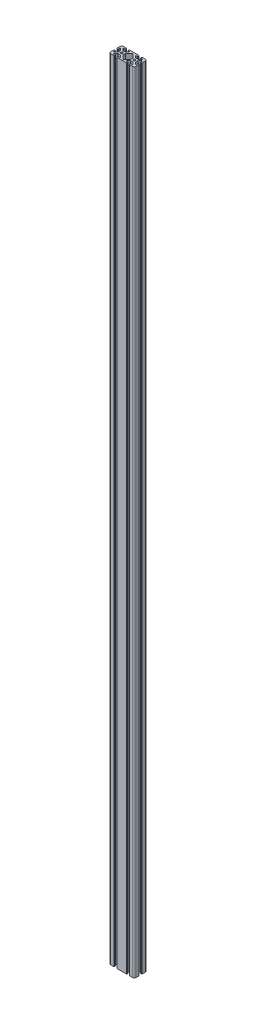
from build123d import *

# Parameters (mm, degrees)
BOSS_EXTRUDE1_DEPTH   = 2500
SKETCH3_R             = 3.4
CUT_EXTRUDE1_DEPTH    = 2502.599488327
CUT_EXTRUDE2_DEPTH    = 2502.599488327
FILLET1_R             = 1
FILLET2_R             = 1
FILLET3_R             = 1
CUT_EXTRUDE3_DEPTH    = 2502.599488327
CUT_EXTRUDE4_DEPTH    = 2502.599488327
FILLET4_R             = 1
FILLET5_R             = 1
FILLET6_R             = 1
FILLET7_R             = 1
FILLET8_R             = 1
FILLET9_R             = 1
FILLET10_R            = 1
FILLET11_R            = 1
MIRROR11_COPY_1_DEPTH = 2502.599488327
MIRROR11_COPY_2_DEPTH = 2502.599488327
CUT_EXTRUDE5_DEPTH    = 2502.599488327


with BuildPart() as part:
    # Sketch1 → Boss-Extrude1 (new body)
    with BuildSketch(Plane(origin=(0, 0, 0), x_dir=(1, 0, 0), z_dir=(0, 1, 0))):
        with BuildLine():
            Line((5, 0), (75, 0))
            ThreePointArc((75, 0), (78.535533906, -1.464466094), (80, -5))
            Line((80, -5), (80, -35))
            ThreePointArc((80, -35), (78.535533906, -38.535533906), (75, -40))
            Line((75, -40), (5, -40))
            ThreePointArc((5, -40), (1.464466094, -38.535533906), (0, -35))
            Line((0, -35), (0, -5))
            ThreePointArc((0, -5), (1.464466094, -1.464466094), (5, 0))
        make_face()
    extrude(amount=BOSS_EXTRUDE1_DEPTH)

    # Sketch3 → Cut-Extrude1 (cut, through all)
    with BuildSketch(Plane(origin=(0, 2500, 0), x_dir=(1, 0, 0), z_dir=(0, 1, 0))):
        with Locations(Location((20, -20, 0), (0, 0, 270))):
            Circle(SKETCH3_R)
    cut_extrude1 = extrude(amount=-CUT_EXTRUDE1_DEPTH, mode=Mode.SUBTRACT)

    # Mirror3: Cut-Extrude1 across plane
    add(cut_extrude1.mirror(Plane(origin=(40, 0, 0), x_dir=(0, 0, 1), z_dir=(1, 0, 0))), mode=Mode.SUBTRACT)

    # Sketch7 → Cut-Extrude2 (cut, through all)
    with BuildSketch(Plane(origin=(0, 0, 0), x_dir=(-1, 0, 0), z_dir=(0, -1, 0))):
        with BuildLine():
            Line((-15.9, -40), (-24.1, -40))
            Line((-24.1, -40), (-24.1, -36.5))
            ThreePointArc((-24.1, -36.5), (-24.392893219, -35.792893219), (-25.1, -35.5))
            Line((-25.1, -35.5), (-29.489753594, -35.5))
            ThreePointArc((-29.489753594, -35.5), (-30.415270825, -34.8787055), (-30.190750526, -33.786835712))
            Line((-30.190750526, -33.786835712), (-24.391814382, -28.086835712))
            ThreePointArc((-24.391814382, -28.086835712), (-24.069522951, -27.874482769), (-23.69081745, -27.8))
            Line((-23.69081745, -27.8), (-16.309186536, -27.8))
            ThreePointArc((-16.309186536, -27.8), (-15.930477876, -27.874484063), (-15.608184734, -28.086840499))
            Line((-15.608184734, -28.086840499), (-9.809327805, -33.786840499))
            ThreePointArc((-9.809327805, -33.786840499), (-9.584813669, -34.87870866), (-10.510329607, -35.5))
            Line((-10.510329607, -35.5), (-14.9, -35.5))
            ThreePointArc((-14.9, -35.5), (-15.607106781, -35.792893219), (-15.9, -36.5))
            Line((-15.9, -36.5), (-15.9, -40))
        make_face()
    cut_extrude2 = extrude(amount=-CUT_EXTRUDE2_DEPTH, mode=Mode.SUBTRACT)

    # Fillet1
    fillet1_edges = [part.edges().sort_by_distance(p)[0] for p in [
        (15.9, 1250, 40),
        (24.1, 1250, 40),
    ]]
    fillet(fillet1_edges, radius=FILLET1_R)

    # Mirror8: Cut-Extrude2 across plane
    add(cut_extrude2.mirror(Plane(origin=(40, 0, 0), x_dir=(0, 0, 1), z_dir=(1, 0, 0))), mode=Mode.SUBTRACT)

    # Fillet2
    fillet2_edges = [part.edges().sort_by_distance(p)[0] for p in [
        (55.9, 1250, 40),
    ]]
    fillet(fillet2_edges, radius=FILLET2_R)

    # Fillet3
    fillet3_edges = [part.edges().sort_by_distance(p)[0] for p in [
        (64.1, 1250, 40),
    ]]
    fillet(fillet3_edges, radius=FILLET3_R)

    # Sketch9 → Cut-Extrude3 (cut, through all)
    with BuildSketch(Plane(origin=(0, 0, 0), x_dir=(1, 0, 0), z_dir=(0, 1, 0))):
        with BuildLine():
            Line((14.899846923, -4.500713815), (10.450461284, -4.500713815))
            ThreePointArc((10.450461284, -4.500713815), (9.526581751, -5.118030383), (9.743354502, -6.207820596))
            Line((9.743354502, -6.207820596), (15.442640687, -11.907106781))
            ThreePointArc((15.442640687, -11.907106781), (15.767064036, -12.123879533), (16.149747468, -12.2))
            Line((16.149747468, -12.2), (23.850252532, -12.2))
            ThreePointArc((23.850252532, -12.2), (24.232935964, -12.123879533), (24.557359313, -11.907106781))
            Line((24.557359313, -11.907106781), (30.257359313, -6.207106781))
            ThreePointArc((30.257359313, -6.207106781), (30.474132064, -5.117316568), (29.550252532, -4.5))
            Line((29.550252532, -4.5), (25.099846964, -4.5))
            ThreePointArc((25.099846964, -4.5), (24.392724723, -4.207091321), (24.099846965, -3.499956273))
            Line((24.099846965, -3.499956273), (24.100000008, 0))
            Line((24.100000008, 0), (15.9, 0))
            Line((15.9, 0), (15.899846922, -3.500757542))
            ThreePointArc((15.899846922, -3.500757542), (15.606938244, -4.207836056), (14.899846923, -4.500713815))
        make_face()
    cut_extrude3 = extrude(amount=CUT_EXTRUDE3_DEPTH, mode=Mode.SUBTRACT)

    # Mirror9: Cut-Extrude3 across plane
    add(cut_extrude3.mirror(Plane(origin=(40, 0, 0), x_dir=(0, 0, 1), z_dir=(1, 0, 0))), mode=Mode.SUBTRACT)

    # Sketch10 → Cut-Extrude4 (cut, through all)
    with BuildSketch(Plane(origin=(0, 0, 0), x_dir=(1, 0, 0), z_dir=(0, 1, 0))):
        with BuildLine():
            Line((4.5, -14.9), (4.5, -10.58605332))
            ThreePointArc((4.5, -10.58605332), (5.126159695, -9.658560233), (6.220486853, -9.892584724))
            Line((6.220486853, -9.892584724), (11.920486853, -15.814662646))
            ThreePointArc((11.920486853, -15.814662646), (12.127493087, -16.134290938), (12.2, -16.508131242))
            Line((12.2, -16.508131242), (12.2, -23.491868758))
            ThreePointArc((12.2, -23.491868758), (12.127493087, -23.865709062), (11.920486853, -24.185337354))
            Line((11.920486853, -24.185337354), (6.220486853, -30.107415276))
            ThreePointArc((6.220486853, -30.107415276), (5.126159695, -30.341439767), (4.5, -29.41394668))
            Line((4.5, -29.41394668), (4.5, -25.1))
            ThreePointArc((4.5, -25.1), (4.207106781, -24.392893219), (3.5, -24.1))
            Line((3.5, -24.1), (0, -24.1))
            Line((0, -24.1), (0, -15.9))
            Line((0, -15.9), (3.5, -15.9))
            ThreePointArc((3.5, -15.9), (4.207106781, -15.607106781), (4.5, -14.9))
        make_face()
    cut_extrude4 = extrude(amount=CUT_EXTRUDE4_DEPTH, mode=Mode.SUBTRACT)

    # Fillet4
    fillet4_edges = [part.edges().sort_by_distance(p)[0] for p in [
        (24.100000008, 1250, 0),
    ]]
    fillet(fillet4_edges, radius=FILLET4_R)

    # Fillet5
    fillet5_edges = [part.edges().sort_by_distance(p)[0] for p in [
        (64.1, 1250, 0),
    ]]
    fillet(fillet5_edges, radius=FILLET5_R)

    # Fillet6
    fillet6_edges = [part.edges().sort_by_distance(p)[0] for p in [
        (55.899999992, 1250, 0),
    ]]
    fillet(fillet6_edges, radius=FILLET6_R)

    # Fillet7
    fillet7_edges = [part.edges().sort_by_distance(p)[0] for p in [
        (15.9, 1250, 0),
    ]]
    fillet(fillet7_edges, radius=FILLET7_R)

    # Fillet8
    fillet8_edges = [part.edges().sort_by_distance(p)[0] for p in [
        (0, 1250, 24.1),
    ]]
    fillet(fillet8_edges, radius=FILLET8_R)

    # Fillet9
    fillet9_edges = [part.edges().sort_by_distance(p)[0] for p in [
        (0, 1250, 15.9),
    ]]
    fillet(fillet9_edges, radius=FILLET9_R)

    # Mirror10: Cut-Extrude4 across plane
    add(cut_extrude4.mirror(Plane(origin=(40, 0, 0), x_dir=(0, 0, 1), z_dir=(1, 0, 0))), mode=Mode.SUBTRACT)

    # Fillet10
    fillet10_edges = [part.edges().sort_by_distance(p)[0] for p in [
        (80, 1250, 15.9),
    ]]
    fillet(fillet10_edges, radius=FILLET10_R)

    # Fillet11
    fillet11_edges = [part.edges().sort_by_distance(p)[0] for p in [
        (80, 1250, 24.1),
    ]]
    fillet(fillet11_edges, radius=FILLET11_R)

    # Mirror11 copy 1 sketch → Mirror11 copy 1 (cut, through all)
    with BuildSketch(Plane(origin=(40, 0, 0), x_dir=(1, 0, 0), z_dir=(0, 1, 0))):
        with BuildLine():
            Line((4.5, -14.9), (4.5, -10.58605332))
            ThreePointArc((4.5, -10.58605332), (5.126159695, -9.658560233), (6.220486853, -9.892584724))
            Line((6.220486853, -9.892584724), (11.920486853, -15.814662646))
            ThreePointArc((11.920486853, -15.814662646), (12.127493087, -16.134290938), (12.2, -16.508131242))
            Line((12.2, -16.508131242), (12.2, -23.491868758))
            ThreePointArc((12.2, -23.491868758), (12.127493087, -23.865709062), (11.920486853, -24.185337354))
            Line((11.920486853, -24.185337354), (6.220486853, -30.107415276))
            ThreePointArc((6.220486853, -30.107415276), (5.126159695, -30.341439767), (4.5, -29.41394668))
            Line((4.5, -29.41394668), (4.5, -25.1))
            ThreePointArc((4.5, -25.1), (4.207106781, -24.392893219), (3.5, -24.1))
            Line((3.5, -24.1), (0, -24.1))
            Line((0, -24.1), (0, -15.9))
            Line((0, -15.9), (3.5, -15.9))
            ThreePointArc((3.5, -15.9), (4.207106781, -15.607106781), (4.5, -14.9))
        make_face()
    extrude(amount=MIRROR11_COPY_1_DEPTH, mode=Mode.SUBTRACT)

    # Mirror11 copy 2 sketch → Mirror11 copy 2 (cut, through all)
    with BuildSketch(Plane(origin=(120, 0, 0), x_dir=(-1, 0, 0), z_dir=(0, 1, 0))):
        with BuildLine():
            Line((4.5, 14.9), (4.5, 10.58605332))
            ThreePointArc((4.5, 10.58605332), (5.126159695, 9.658560233), (6.220486853, 9.892584724))
            Line((6.220486853, 9.892584724), (11.920486853, 15.814662646))
            ThreePointArc((11.920486853, 15.814662646), (12.127493087, 16.134290938), (12.2, 16.508131242))
            Line((12.2, 16.508131242), (12.2, 23.491868758))
            ThreePointArc((12.2, 23.491868758), (12.127493087, 23.865709062), (11.920486853, 24.185337354))
            Line((11.920486853, 24.185337354), (6.220486853, 30.107415276))
            ThreePointArc((6.220486853, 30.107415276), (5.126159695, 30.341439767), (4.5, 29.41394668))
            Line((4.5, 29.41394668), (4.5, 25.1))
            ThreePointArc((4.5, 25.1), (4.207106781, 24.392893219), (3.5, 24.1))
            Line((3.5, 24.1), (0, 24.1))
            Line((0, 24.1), (0, 15.9))
            Line((0, 15.9), (3.5, 15.9))
            ThreePointArc((3.5, 15.9), (4.207106781, 15.607106781), (4.5, 14.9))
        make_face()
    extrude(amount=MIRROR11_COPY_2_DEPTH, mode=Mode.SUBTRACT)

    # Mirror12: Cut-Extrude4 across plane
    add(cut_extrude4.mirror(Plane.ZY.offset(-20)), mode=Mode.SUBTRACT)

    # Sketch12 → Cut-Extrude5 (cut, through all)
    with BuildSketch(Plane(origin=(0, 0, 0), x_dir=(-1, 0, 0), z_dir=(0, -1, 0))):
        with BuildLine():
            Line((-28.079513147, -24.185337354), (-39.327067998, -35.871108628))
            ThreePointArc((-39.327067998, -35.871108628), (-40.049082116, -36.177638866), (-40.770156561, -35.868904648))
            Line((-40.770156561, -35.868904648), (-51.922601709, -24.210885791))
            ThreePointArc((-51.922601709, -24.210885791), (-52.128062958, -23.892044517), (-52.2, -23.519621175))
            Line((-52.2, -23.519621175), (-52.2, -16.508131242))
            ThreePointArc((-52.2, -16.508131242), (-52.127493087, -16.134290938), (-51.920486853, -15.814662646))
            Line((-51.920486853, -15.814662646), (-40.720486853, -4.17829901))
            ThreePointArc((-40.720486853, -4.17829901), (-40, -3.871767606), (-39.279513147, -4.17829901))
            Line((-39.279513147, -4.17829901), (-28.079513147, -15.814662646))
            ThreePointArc((-28.079513147, -15.814662646), (-27.872506913, -16.134290938), (-27.8, -16.508131242))
            Line((-27.8, -16.508131242), (-27.8, -23.491868758))
            ThreePointArc((-27.8, -23.491868758), (-27.872506913, -23.865709062), (-28.079513147, -24.185337354))
        make_face()
    extrude(amount=-CUT_EXTRUDE5_DEPTH, mode=Mode.SUBTRACT)


solid = part.part
